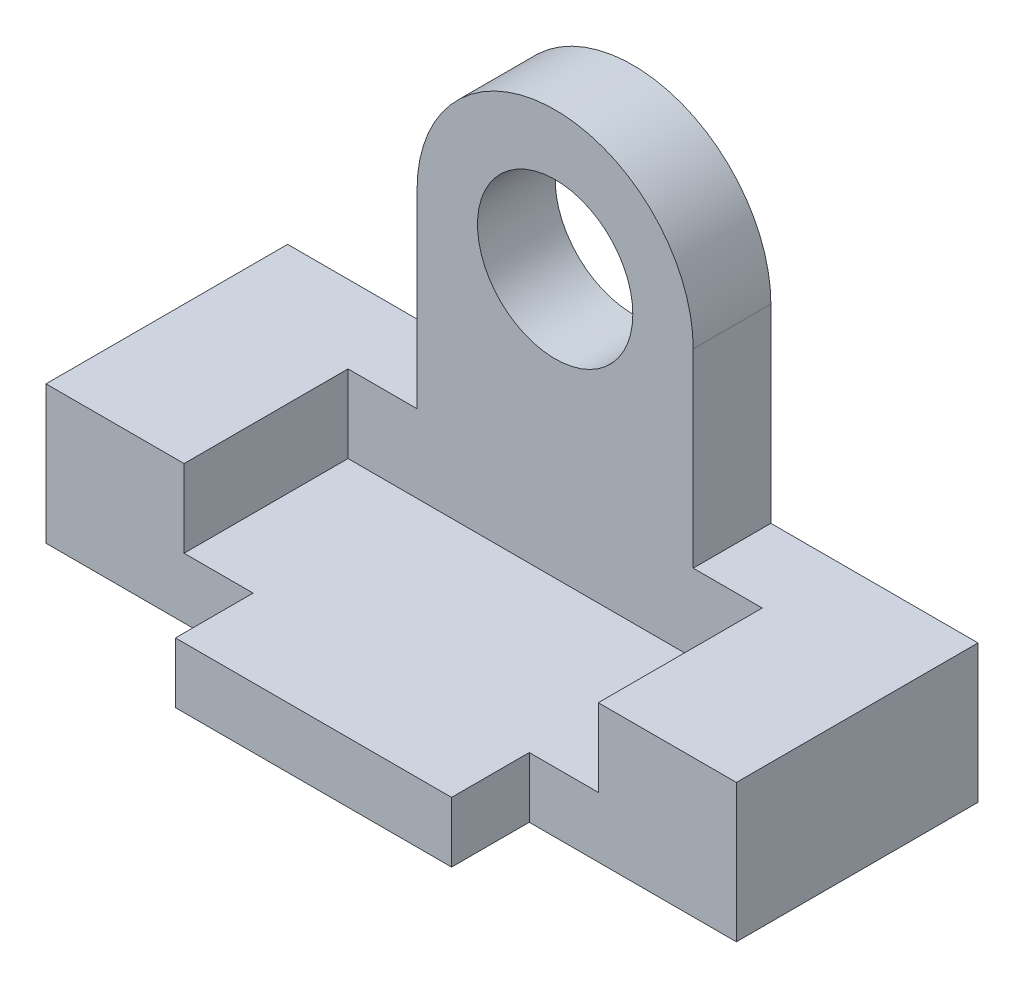
from build123d import *

# Parameters (mm, degrees)
SKETCH_1_W          = 80
SKETCH_1_H          = 28
EXTRUDE_1_DEPTH     = 16
SKETCH_2_W          = 48
SKETCH_2_H          = 19
CUT_EXTRUDE_1_DEPTH = 9
SKETCH_3_W          = 32
SKETCH_3_H          = 7
EXTRUDE_2_DEPTH     = 9
SKETCH_4_R          = 9
EXTRUDE_3_DEPTH     = 9


with BuildPart() as part:
    # 草图1 → 凸台-拉伸1 (new body)
    with BuildSketch(Plane(origin=(0, 0, 0), x_dir=(1, 0, 0), z_dir=(0, 1, 0))):
        Rectangle(SKETCH_1_W, SKETCH_1_H)
    extrude(amount=EXTRUDE_1_DEPTH)

    # 草图2 → 切除-拉伸1 (cut)
    with BuildSketch(Plane(origin=(0, 16, 0), x_dir=(1, 0, 0), z_dir=(0, 1, 0))):
        with Locations((0, -4.5)):
            Rectangle(SKETCH_2_W, SKETCH_2_H)
    extrude(amount=-CUT_EXTRUDE_1_DEPTH, mode=Mode.SUBTRACT)

    # 草图3 → 凸台-拉伸2 (add)
    with BuildSketch(Plane.XY.offset(14)):
        with Locations((0, 3.5)):
            Rectangle(SKETCH_3_W, SKETCH_3_H)
    extrude(amount=EXTRUDE_2_DEPTH)

    # 草图4 → 凸台-拉伸3 (add)
    with BuildSketch(Plane.XY.offset(-5)):
        with BuildLine():
            Line((-16, 16), (16, 16))
            Line((16, 16), (16, 38))
            ThreePointArc((16, 38), (0, 54), (-16, 38))
            Line((-16, 38), (-16, 16))
        make_face()
        with Locations((0, 38)):
            Circle(SKETCH_4_R, mode=Mode.SUBTRACT)
    extrude(amount=-EXTRUDE_3_DEPTH)


solid = part.part
